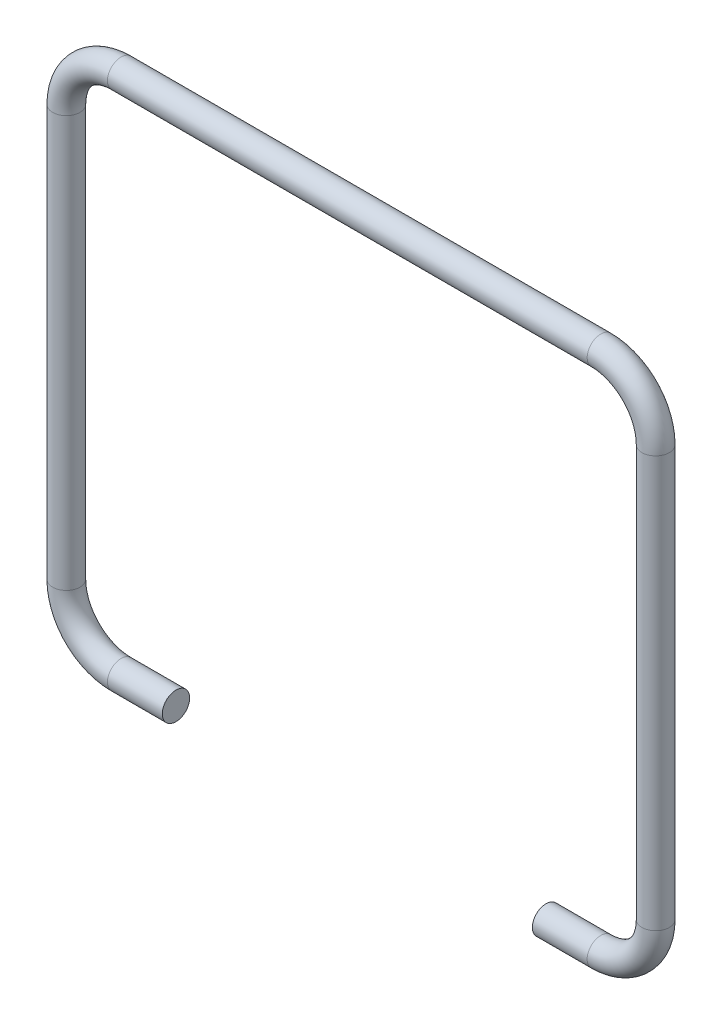
from build123d import *

# Parameters (mm, degrees)
SWEEP_1_PROFILE_R = 0.5


with BuildPart() as part:
    # 扫描1: sweep along a path in 草图1
    with BuildLine(Plane.XY) as sweep_1_path:
        Line((-6.75, 0), (-8.75, 0))
        ThreePointArc((-8.75, 0), (-10.164213562, 0.585786438), (-10.75, 2))
        Line((-10.75, 2), (-10.75, 17))
        ThreePointArc((-10.75, 17), (-10.164213562, 18.414213562), (-8.75, 19))
        Line((-8.75, 19), (8.75, 19))
        ThreePointArc((8.75, 19), (10.164213562, 18.414213562), (10.75, 17))
        Line((10.75, 17), (10.75, 2))
        ThreePointArc((10.75, 2), (10.164213562, 0.585786438), (8.75, 0))
        Line((8.75, 0), (6.75, 0))
    # 扫描1 profile (on start of the path) → 扫描1 (sweep)
    with BuildSketch(Plane(origin=(-6.75, 0, 0), x_dir=(0, -1, 0), z_dir=(-1, 0, 0))):
        Circle(SWEEP_1_PROFILE_R)
    sweep(path=sweep_1_path.line)


solid = part.part
